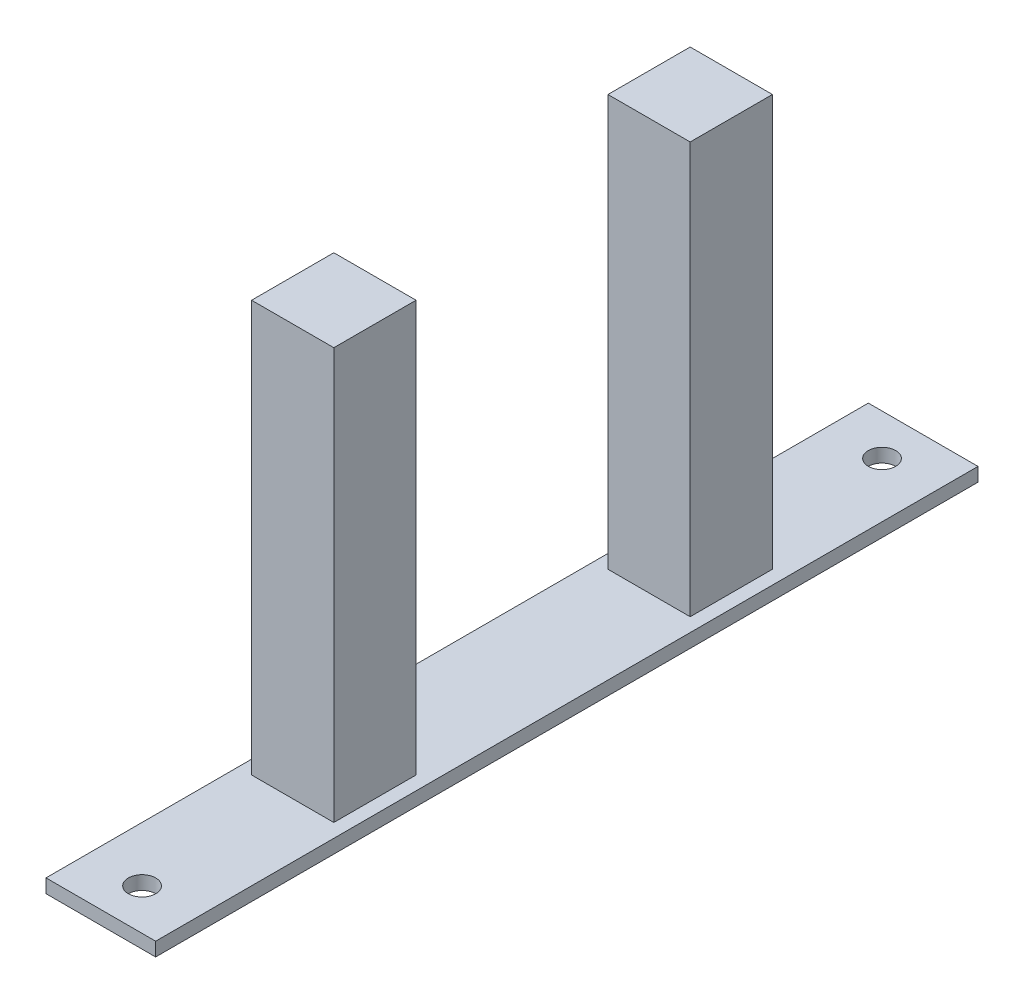
from build123d import *

# Parameters (mm, degrees)
SKETCH1_W           = 40
SKETCH1_H           = 300
BOSS_EXTRUDE1_DEPTH = 5
SKETCH2_W           = 30
SKETCH2_H           = 30
BOSS_EXTRUDE2_DEPTH = 150
SKETCH3_R           = 5
CUT_EXTRUDE2_DEPTH  = 5
SKETCH6_R           = 5
CUT_EXTRUDE3_DEPTH  = 5


with BuildPart() as part:
    # Sketch1 → Boss-Extrude1 (new body)
    with BuildSketch(Plane(origin=(0, 0, 0), x_dir=(1, 0, 0), z_dir=(0, 1, 0))):
        Rectangle(SKETCH1_W, SKETCH1_H)
    extrude(amount=BOSS_EXTRUDE1_DEPTH)

    # Sketch2 → Boss-Extrude2 (add)
    with BuildSketch(Plane(origin=(0, 5, 0), x_dir=(1, 0, 0), z_dir=(0, 1, 0))):
        with Locations((0, 65)):
            Rectangle(SKETCH2_W, SKETCH2_H)
        with Locations((0, -65)):
            Rectangle(SKETCH2_W, SKETCH2_H)
    extrude(amount=BOSS_EXTRUDE2_DEPTH)

    # Sketch3 → Cut-Extrude2 (cut)
    with BuildSketch(Plane(origin=(0, 5, 0), x_dir=(1, 0, 0), z_dir=(0, 1, 0))):
        with Locations(Location((-0.022747462, 135, 0), (0, 0, 270))):
            Circle(SKETCH3_R)
    extrude(amount=-CUT_EXTRUDE2_DEPTH, mode=Mode.SUBTRACT)

    # Sketch6 → Cut-Extrude3 (cut)
    with BuildSketch(Plane(origin=(0, 5, 0), x_dir=(1, 0, 0), z_dir=(0, 1, 0))):
        with Locations(Location((0.036186428, -135, 0), (0, 0, 270))):
            Circle(SKETCH6_R)
    extrude(amount=-CUT_EXTRUDE3_DEPTH, mode=Mode.SUBTRACT)


solid = part.part
